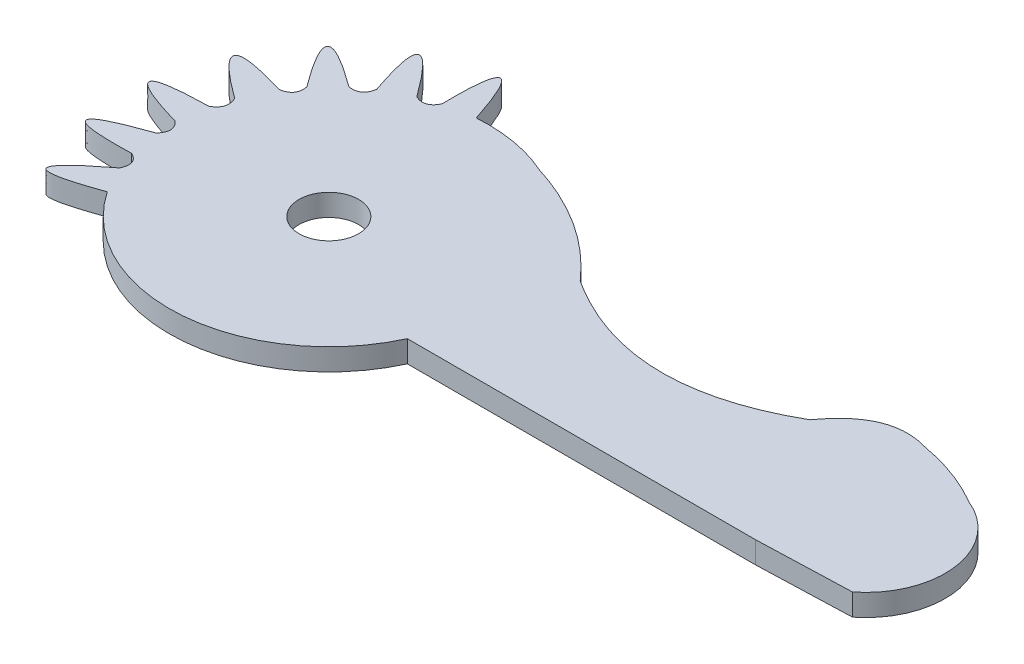
from build123d import *

# Parameters (mm, degrees)
SKETCH_1_R      = 3
EXTRUDE_1_DEPTH = 2.2


with BuildPart() as part:
    # 草图1 → 凸台-拉伸1 (new body)
    with BuildSketch(Plane(origin=(0, 0, 0), x_dir=(1, 0, 0), z_dir=(0, 1, 0))):
        with BuildLine():
            Line((14.611038219, -6.7), (49.690443214, -6.7))
            Line((49.690443214, -6.7), (59.14213471, -6.376451123))
            ThreePointArc((59.14213471, -6.376451123), (62.116009682, 1.036036266), (57.195522798, 7.327118086))
            add(Edge.make_bspline(
                [(50.347107534, 9.880159683), (52.761361064, 9.443859829), (55.044166152, 8.592845964), (57.195522798, 7.327118086)],
                knots=[0.288436631, 0.288436631, 0.288436631, 0.288436631, 1, 1, 1, 1], degree=3))
            add(Edge.make_bspline(
                [(41.984360593, 6.514151987), (43.667045792, 8.848960271), (46.317081673, 10.55679372), (49.303704664, 10.196073302), (50.347107534, 9.880159683)],
                knots=[0.090085046, 0.090085046, 0.090085046, 0.090085046, 0.520368733, 0.736118782, 0.736118782, 0.736118782, 0.736118782], degree=3))
            add(Edge.make_bspline(
                [(18.29395406, 7.037125327), (29.823970963, -0.449921726), (41.984360593, 6.514151987)],
                knots=[0, 0, 0, 1, 1, 1], degree=2))
            add(Edge.make_bspline(
                [(6.555128163, 14.676604942), (13.508953417, 12.492816522), (18.29395406, 7.037125327)],
                knots=[0, 0, 0, 1, 1, 1], degree=2))
            ThreePointArc((6.555128163, 14.676604942), (2.774471684, 15.832711225), (-1.174023286, 16.031035749))
            add(Edge.make_bspline(
                [(-4.132506817, 15.533667476), (-4.311159294, 25.643963381), (-1.174023286, 16.031035749)],
                knots=[0, 0, 0, 1, 1, 1], degree=2))
            add(Edge.make_bspline(
                [(-6.029547406, 14.900234761), (-4.764310754, 14.268430824), (-4.132506817, 15.533667476)],
                knots=[0, 0, 0, 1, 1, 1], degree=2))
            add(Edge.make_bspline(
                [(-8.69333509, 13.520294481), (-11.961242179, 23.089556901), (-6.029547406, 14.900234761)],
                knots=[0, 0, 0, 1, 1, 1], degree=2))
            add(Edge.make_bspline(
                [(-10.305043141, 12.336065974), (-8.907074862, 12.122326202), (-8.69333509, 13.520294481)],
                knots=[0, 0, 0, 1, 1, 1], degree=2))
            add(Edge.make_bspline(
                [(-12.417884822, 10.206300721), (-18.460681491, 18.31398895), (-10.305043141, 12.336065974)],
                knots=[0, 0, 0, 1, 1, 1], degree=2))
            add(Edge.make_bspline(
                [(-13.589217783, 8.585196439), (-12.192999161, 8.810082099), (-12.417884822, 10.206300721)],
                knots=[0, 0, 0, 1, 1, 1], degree=2))
            add(Edge.make_bspline(
                [(-15.07242577, 5.585196439), (-23.295073991, 11.517146599), (-13.589217783, 8.585196439)],
                knots=[0, 0, 0, 1, 1, 1], degree=2))
            add(Edge.make_bspline(
                [(-15.669039675, 3.585196439), (-14.412461062, 4.29933734), (-15.07242577, 5.585196439)],
                knots=[0, 0, 0, 1, 1, 1], degree=2))
            add(Edge.make_bspline(
                [(-16.063311706, 0.585196439), (-25.780917218, 3.388231532), (-15.669039675, 3.585196439)],
                knots=[0, 0, 0, 1, 1, 1], degree=2))
            add(Edge.make_bspline(
                [(-16.011582331, -1.414803561), (-15.037875075, -0.394118455), (-16.063311706, 0.585196439)],
                knots=[0, 0, 0, 1, 1, 1], degree=2))
            add(Edge.make_bspline(
                [(-15.455806267, -4.414803561), (-25.566384923, -4.736394924), (-16.011582331, -1.414803561)],
                knots=[0, 0, 0, 1, 1, 1], degree=2))
            add(Edge.make_bspline(
                [(-14.787919584, -6.299989859), (-14.179269776, -5.023453369), (-15.455806267, -4.414803561)],
                knots=[0, 0, 0, 1, 1, 1], degree=2))
            add(Edge.make_bspline(
                [(-13.318124412, -9), (-22.835991784, -12.431149783), (-14.787919584, -6.299989859)],
                knots=[0, 0, 0, 1, 1, 1], degree=2))
            ThreePointArc((-13.318124412, -9), (1.319244681, -16.019738803), (14.611038219, -6.7))
        make_face()
        with Locations(Location((0, 0, 0), (0, 0, 270))):
            Circle(SKETCH_1_R, mode=Mode.SUBTRACT)
    extrude(amount=EXTRUDE_1_DEPTH)


solid = part.part
